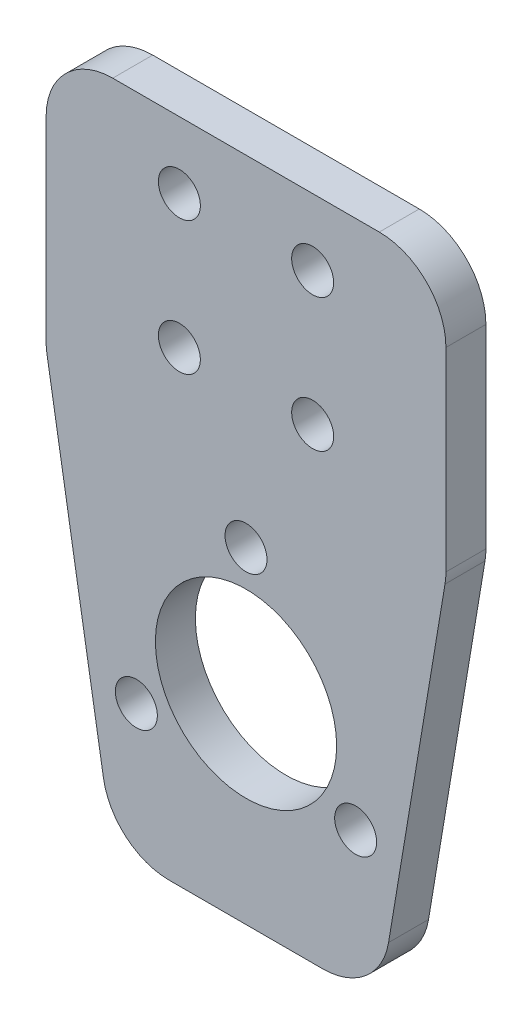
from build123d import *

# Parameters (mm, degrees)
EXTRUDE_1_DEPTH     = 3
SKETCH_2_R          = 1.575
SKETCH_2_R_2        = 6.8
CUT_EXTRUDE_2_DEPTH = 59.386642308
FILLET_1_R          = 5


with BuildPart() as part:
    # 草图1 → 凸台-拉伸1 (new body)
    with BuildSketch(Plane.XY):
        Polygon((0, 0), (0, -20), (5, -50), (25, -50), (30, -20), (30, 0), align=None)
    extrude(amount=EXTRUDE_1_DEPTH)

    # 草图2 → 切除-拉伸2 (cut, through all)
    with BuildSketch(Plane.XY.offset(3)):
        with Locations(Location((10, -5, 0), (0, 0, 180))):
            Circle(SKETCH_2_R)
        with Locations((10, -15)):
            Circle(SKETCH_2_R)
        with Locations(Location((20, -15, 0), (0, 0, 180))):
            Circle(SKETCH_2_R)
        with Locations((20, -5)):
            Circle(SKETCH_2_R)
        with Locations((15, -35)):
            Circle(SKETCH_2_R_2)
        with Locations((15, -25.5)):
            Circle(SKETCH_2_R)
        with Locations((23.227241336, -39.75)):
            Circle(SKETCH_2_R)
        with Locations((6.772758664, -39.75)):
            Circle(SKETCH_2_R)
    extrude(amount=-CUT_EXTRUDE_2_DEPTH, mode=Mode.SUBTRACT)

    # 圆角1
    fillet_1_edges = [part.edges().sort_by_distance(p)[0] for p in [
        (30, 0, 1.5),
        (30, -20, 1.5),
        (25, -50, 1.5),
        (5, -50, 1.5),
        (0, -20, 1.5),
        (0, 0, 1.5),
    ]]
    fillet(fillet_1_edges, radius=FILLET_1_R)


solid = part.part
